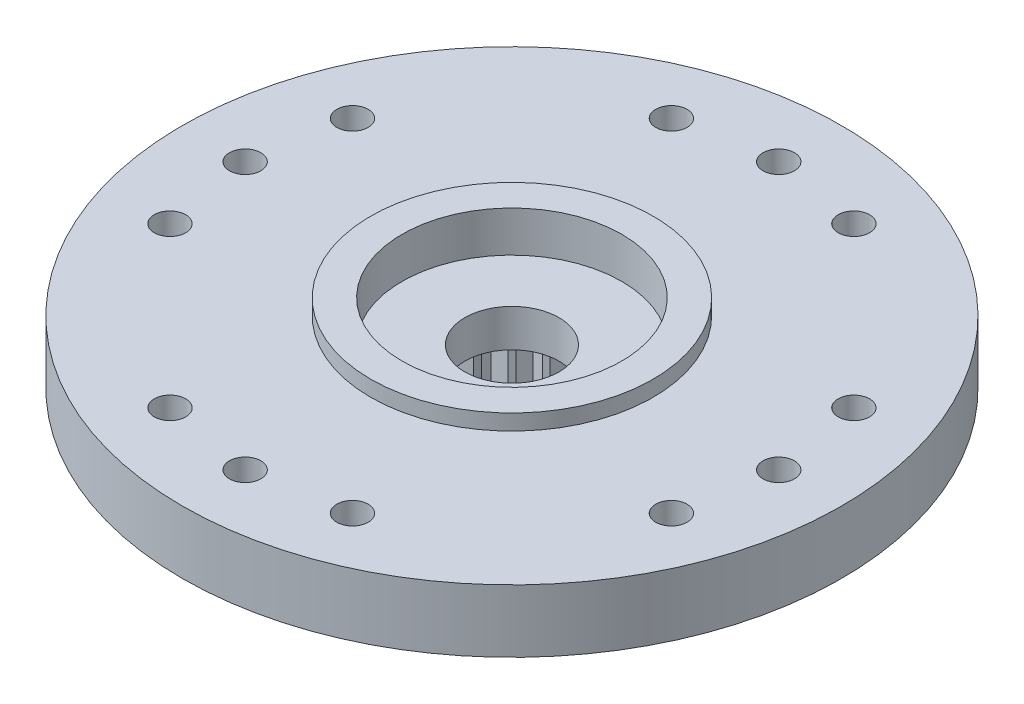
from build123d import *

# Parameters (mm, degrees)
SKETCH1_R           = 10.5
SKETCH1_R_2         = 1.5
SKETCH1_R_3         = 0.5
BOSS_EXTRUDE1_DEPTH = 2
SKETCH2_R           = 4.5
SKETCH2_R_2         = 3.5
BOSS_EXTRUDE2_DEPTH = 0.5
CUT_EXTRUDE1_START  = -0.8
SKETCH3_R           = 3.5
SKETCH3_R_2         = 1.5
CUT_EXTRUDE1_DEPTH  = 0.8
BOSS_EXTRUDE3_START = 2.5
SKETCH4_R           = 4.5
SKETCH4_R_2         = 2.5
BOSS_EXTRUDE3_DEPTH = 2.5
CUT_EXTRUDE3_DEPTH  = 2.5


with BuildPart() as part:
    # Sketch1 → Boss-Extrude1 (new body)
    with BuildSketch(Plane(origin=(0, 0, 0), x_dir=(1, 0, 0), z_dir=(0, 1, 0))):
        with Locations(Location((0, 0, 0), (0, 0, 270))):
            Circle(SKETCH1_R)
        with Locations(Location((0, 0, 0), (0, 0, 270))):
            Circle(SKETCH1_R_2, mode=Mode.SUBTRACT)
        with Locations(Location((2.907171218, 7.987387277, 0), (0, 0, 270))):
            Circle(SKETCH1_R_3, mode=Mode.SUBTRACT)
        with Locations(Location((-2.907171218, 7.987387277, 0), (0, 0, 270))):
            Circle(SKETCH1_R_3, mode=Mode.SUBTRACT)
        with Locations(Location((2.907171218, -7.987387277, 0), (0, 0, 90))):
            Circle(SKETCH1_R_3, mode=Mode.SUBTRACT)
        with Locations(Location((-2.907171218, -7.987387277, 0), (0, 0, 90))):
            Circle(SKETCH1_R_3, mode=Mode.SUBTRACT)
        with Locations(Location((0, -8.5, 0), (0, 0, 90))):
            Circle(SKETCH1_R_3, mode=Mode.SUBTRACT)
        with Locations(Location((8.5, 0, 0), (0, 0, 270))):
            Circle(SKETCH1_R_3, mode=Mode.SUBTRACT)
        with Locations(Location((7.987387277, 2.907171218, 0), (0, 0, 270))):
            Circle(SKETCH1_R_3, mode=Mode.SUBTRACT)
        with Locations(Location((7.987387277, -2.907171218, 0), (0, 0, 270))):
            Circle(SKETCH1_R_3, mode=Mode.SUBTRACT)
        with Locations(Location((-7.987387277, -2.907171218, 0), (0, 0, 90))):
            Circle(SKETCH1_R_3, mode=Mode.SUBTRACT)
        with Locations(Location((-8.5, 0, 0), (0, 0, 90))):
            Circle(SKETCH1_R_3, mode=Mode.SUBTRACT)
        with Locations(Location((-7.987387277, 2.907171218, 0), (0, 0, 90))):
            Circle(SKETCH1_R_3, mode=Mode.SUBTRACT)
        with Locations(Location((0, 8.5, 0), (0, 0, 270))):
            Circle(SKETCH1_R_3, mode=Mode.SUBTRACT)
    extrude(amount=BOSS_EXTRUDE1_DEPTH)

    # Sketch2 → Boss-Extrude2 (add)
    with BuildSketch(Plane(origin=(0, 2, 0), x_dir=(1, 0, 0), z_dir=(0, 1, 0))):
        with Locations(Location((0, 0, 0), (0, 0, 270))):
            Circle(SKETCH2_R)
        with Locations(Location((0, 0, 0), (0, 0, 270))):
            Circle(SKETCH2_R_2, mode=Mode.SUBTRACT)
    extrude(amount=BOSS_EXTRUDE2_DEPTH)

    # Sketch3 → Cut-Extrude1 (cut)
    with BuildSketch(Plane(origin=(0, 2, 0), x_dir=(1, 0, 0), z_dir=(0, 1, 0)).offset(CUT_EXTRUDE1_START)):
        with Locations(Location((0, 0, 0), (0, 0, 270))):
            Circle(SKETCH3_R)
        with Locations(Location((0, 0, 0), (0, 0, 270))):
            Circle(SKETCH3_R_2, mode=Mode.SUBTRACT)
    extrude(amount=CUT_EXTRUDE1_DEPTH, mode=Mode.SUBTRACT)

    # Sketch4 → Boss-Extrude3 (add)
    with BuildSketch(Plane.XZ.offset(BOSS_EXTRUDE3_START)):
        with Locations(Location((0, 0, 0), (0, 0, 90))):
            Circle(SKETCH4_R)
        with Locations(Location((0, 0, 0), (0, 0, 270))):
            Circle(SKETCH4_R_2, mode=Mode.SUBTRACT)
    extrude(amount=-BOSS_EXTRUDE3_DEPTH)

    # Sketch5 → Cut-Extrude3 (cut)
    with BuildSketch(Plane.XZ.offset(2.5)):
        with BuildLine():
            Line((0.299038106, 2.482050808), (0, 3))
            Line((0, 3), (-0.299038106, 2.482050808))
            ThreePointArc((-0.299038106, 2.482050808), (-0.391086163, 2.469220851), (-0.482593741, 2.452978451))
            Line((-0.482593741, 2.452978451), (-0.927050983, 2.853169549))
            Line((-0.927050983, 2.853169549), (-1.051398019, 2.268162738))
            ThreePointArc((-1.051398019, 2.268162738), (-1.134976249, 2.22751631), (-1.216985951, 2.183791473))
            Line((-1.216985951, 2.183791473), (-1.763355757, 2.427050983))
            Line((-1.763355757, 2.427050983), (-1.70083977, 1.832251096))
            ThreePointArc((-1.70083977, 1.832251096), (-1.767766953, 1.767766953), (-1.832251096, 1.70083977))
            Line((-1.832251096, 1.70083977), (-2.427050983, 1.763355757))
            Line((-2.427050983, 1.763355757), (-2.183791473, 1.216985951))
            ThreePointArc((-2.183791473, 1.216985951), (-2.22751631, 1.134976249), (-2.268162738, 1.051398019))
            Line((-2.268162738, 1.051398019), (-2.853169549, 0.927050983))
            Line((-2.853169549, 0.927050983), (-2.452978451, 0.482593741))
            ThreePointArc((-2.452978451, 0.482593741), (-2.469220851, 0.391086163), (-2.482050808, 0.299038106))
            Line((-2.482050808, 0.299038106), (-3, 0))
            Line((-3, 0), (-2.482050808, -0.299038106))
            ThreePointArc((-2.482050808, -0.299038106), (-2.469220851, -0.391086163), (-2.452978451, -0.482593741))
            Line((-2.452978451, -0.482593741), (-2.853169549, -0.927050983))
            Line((-2.853169549, -0.927050983), (-2.268162738, -1.051398019))
            ThreePointArc((-2.268162738, -1.051398019), (-2.22751631, -1.134976249), (-2.183791473, -1.216985951))
            Line((-2.183791473, -1.216985951), (-2.427050983, -1.763355757))
            Line((-2.427050983, -1.763355757), (-1.832251096, -1.70083977))
            ThreePointArc((-1.832251096, -1.70083977), (-1.767766953, -1.767766953), (-1.70083977, -1.832251096))
            Line((-1.70083977, -1.832251096), (-1.763355757, -2.427050983))
            Line((-1.763355757, -2.427050983), (-1.216985951, -2.183791473))
            ThreePointArc((-1.216985951, -2.183791473), (-1.134976249, -2.22751631), (-1.051398019, -2.268162738))
            Line((-1.051398019, -2.268162738), (-0.927050983, -2.853169549))
            Line((-0.927050983, -2.853169549), (-0.482593741, -2.452978451))
            ThreePointArc((-0.482593741, -2.452978451), (-0.391086163, -2.469220851), (-0.299038106, -2.482050808))
            Line((-0.299038106, -2.482050808), (0, -3))
            Line((0, -3), (0.299038106, -2.482050808))
            ThreePointArc((0.299038106, -2.482050808), (0.391086163, -2.469220851), (0.482593741, -2.452978451))
            Line((0.482593741, -2.452978451), (0.927050983, -2.853169549))
            Line((0.927050983, -2.853169549), (1.051398019, -2.268162738))
            ThreePointArc((1.051398019, -2.268162738), (1.134976249, -2.22751631), (1.216985951, -2.183791473))
            Line((1.216985951, -2.183791473), (1.763355757, -2.427050983))
            Line((1.763355757, -2.427050983), (1.70083977, -1.832251096))
            ThreePointArc((1.70083977, -1.832251096), (1.767766953, -1.767766953), (1.832251096, -1.70083977))
            Line((1.832251096, -1.70083977), (2.427050983, -1.763355757))
            Line((2.427050983, -1.763355757), (2.183791473, -1.216985951))
            ThreePointArc((2.183791473, -1.216985951), (2.22751631, -1.134976249), (2.268162738, -1.051398019))
            Line((2.268162738, -1.051398019), (2.853169549, -0.927050983))
            Line((2.853169549, -0.927050983), (2.452978451, -0.482593741))
            ThreePointArc((2.452978451, -0.482593741), (2.469220851, -0.391086163), (2.482050808, -0.299038106))
            Line((2.482050808, -0.299038106), (3, 0))
            Line((3, 0), (2.482050808, 0.299038106))
            ThreePointArc((2.482050808, 0.299038106), (2.469220851, 0.391086163), (2.452978451, 0.482593741))
            Line((2.452978451, 0.482593741), (2.853169549, 0.927050983))
            Line((2.853169549, 0.927050983), (2.268162738, 1.051398019))
            ThreePointArc((2.268162738, 1.051398019), (2.22751631, 1.134976249), (2.183791473, 1.216985951))
            Line((2.183791473, 1.216985951), (2.427050983, 1.763355757))
            Line((2.427050983, 1.763355757), (1.832251096, 1.70083977))
            ThreePointArc((1.832251096, 1.70083977), (1.767766953, 1.767766953), (1.70083977, 1.832251096))
            Line((1.70083977, 1.832251096), (1.763355757, 2.427050983))
            Line((1.763355757, 2.427050983), (1.216985951, 2.183791473))
            ThreePointArc((1.216985951, 2.183791473), (1.134976249, 2.22751631), (1.051398019, 2.268162738))
            Line((1.051398019, 2.268162738), (0.927050983, 2.853169549))
            Line((0.927050983, 2.853169549), (0.482593741, 2.452978451))
            ThreePointArc((0.482593741, 2.452978451), (0.391086163, 2.469220851), (0.299038106, 2.482050808))
        make_face()
    extrude(amount=-CUT_EXTRUDE3_DEPTH, mode=Mode.SUBTRACT)


solid = part.part
